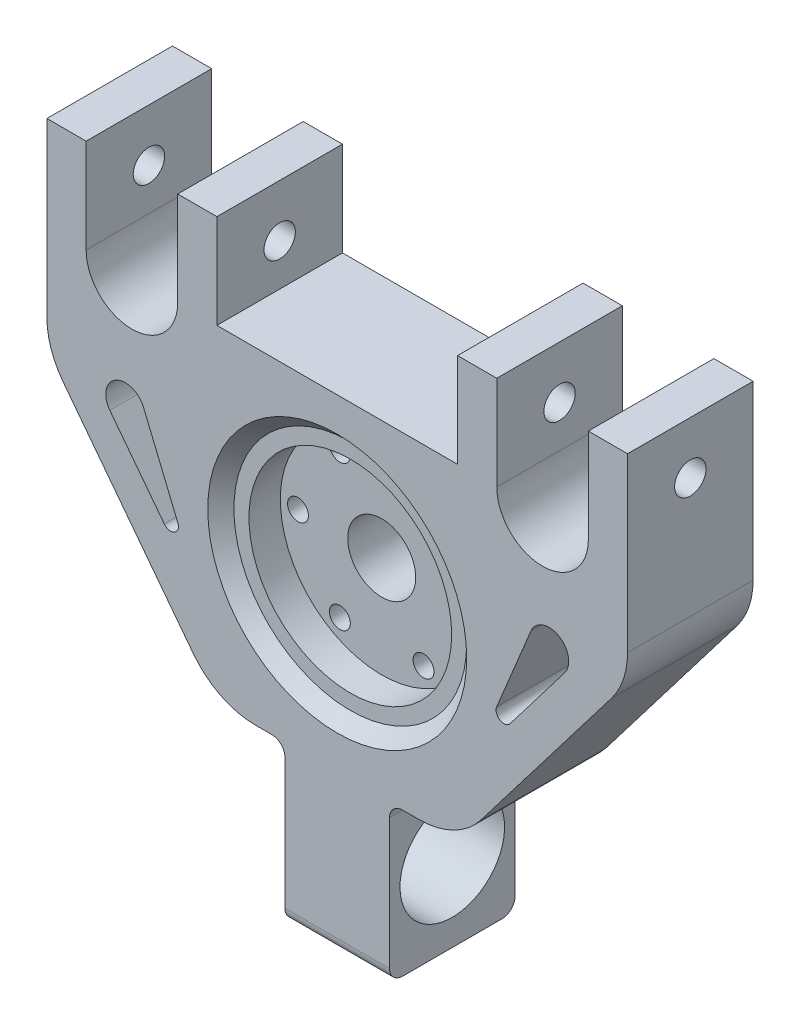
from build123d import *

# Parameters (mm, degrees)
DODANIE_WYCI_GNI_CIE1_DEPTH      = 13.5
DODANIE_WYCI_GNI_CIE1_DEPTH_BACK = 13.5
SZKIC1_W                         = 222
SZKIC1_H                         = 125
SZKIC1_R                         = 13
SZKIC1_R_2                       = 4
SZKIC4_W                         = 15
SZKIC4_H                         = 27
DODANIE_WYCI_GNI_CIE4_DEPTH      = 36
SZKIC13_R                        = 38.75
WYTNIJ_WYCI_GNI_CIE4_DEPTH       = 17
SZKIC15_R                        = 44.5
WYTNIJ_WYCI_GNI_CIE5_DEPTH       = 5
POCHYLENIE1_ANGLE                = 45
DODANIE_WYCI_GNI_CIE6_START      = 21
SZKIC16_R                        = 13
SZKIC16_R_2                      = 4
DODANIE_WYCI_GNI_CIE6_DEPTH      = 21
SZKIC5_R                         = 6
WYTNIJ_WYCI_GNI_CIE3_DEPTH       = 246.308988828
WYTNIJ_WYCI_GNI_CIE6_DEPTH       = 156.971952607
ZAOKR_GLENIE1_R                  = 30
ZAOKR_GLENIE2_R                  = 30
SZKIC19_W                        = 40
SZKIC19_H                        = 60
DODANIE_WYCI_GNI_CIE7_DEPTH      = 48
WYTNIJ_WYCI_GNI_CIE7_REACH       = 184.64
SZKIC23_R                        = 20
WYTNIJ_WYCI_GNI_CIE8_REACH       = 174.137
ZAOKR_GLENIE4_R                  = 5
ZAOKR_GLENIE5_R                  = 5
WYTNIJ_WYCI_GNI_CIE9_DEPTH       = 48


with BuildPart() as part:
    # Szkic1 → Dodanie-wyciągnięcie1 (new, two sides: drawn at the far end of the back side and taken through both)
    with BuildSketch(Plane.XY.offset(-DODANIE_WYCI_GNI_CIE1_DEPTH_BACK)):
        Rectangle(SZKIC1_W, SZKIC1_H)
        Circle(SZKIC1_R, mode=Mode.SUBTRACT)
        with Locations((-32, 0)):
            Circle(SZKIC1_R_2, mode=Mode.SUBTRACT)
        with Locations((-16, 27.712812921)):
            Circle(SZKIC1_R_2, mode=Mode.SUBTRACT)
        with Locations((16, 27.712812921)):
            Circle(SZKIC1_R_2, mode=Mode.SUBTRACT)
        with Locations((32, 0)):
            Circle(SZKIC1_R_2, mode=Mode.SUBTRACT)
        with Locations((16, -27.712812921)):
            Circle(SZKIC1_R_2, mode=Mode.SUBTRACT)
        with Locations((-16, -27.712812921)):
            Circle(SZKIC1_R_2, mode=Mode.SUBTRACT)
    extrude(amount=DODANIE_WYCI_GNI_CIE1_DEPTH + DODANIE_WYCI_GNI_CIE1_DEPTH_BACK)

    # Szkic4 → Dodanie-wyciągnięcie4 (add)
    with BuildSketch(Plane(origin=(0, 62.5, 0), x_dir=(1, 0, 0), z_dir=(0, 1, 0))):
        with Locations((-103.5, 0)):
            Rectangle(SZKIC4_W, SZKIC4_H)
        with Locations((-53.5, 0)):
            Rectangle(SZKIC4_W, SZKIC4_H)
        with Locations((53.5, 0)):
            Rectangle(SZKIC4_W, SZKIC4_H)
        with Locations((103.5, 0)):
            Rectangle(SZKIC4_W, SZKIC4_H)
    extrude(amount=DODANIE_WYCI_GNI_CIE4_DEPTH)

    # Szkic13 → Wytnij-wyciągnięcie4 (cut)
    with BuildSketch(Plane.XY.offset(13.5)):
        Circle(SZKIC13_R)
    extrude(amount=-WYTNIJ_WYCI_GNI_CIE4_DEPTH, mode=Mode.SUBTRACT)

    # Szkic15 → Wytnij-wyciągnięcie5 (cut)
    with BuildSketch(Plane.XY.offset(13.5)):
        Circle(SZKIC15_R)
    extrude(amount=-WYTNIJ_WYCI_GNI_CIE5_DEPTH, mode=Mode.SUBTRACT)

    # Pochylenie1
    pochylenie1_faces = [part.faces().sort_by_distance(p)[0] for p in [
        (-44.5, 0, 11),
    ]]
    draft(pochylenie1_faces, Plane.XY.offset(8.5), POCHYLENIE1_ANGLE)

    # Szkic16 → Dodanie-wyciągnięcie6 (add)
    with BuildSketch(Plane(origin=(0, 0, -13.5), x_dir=(-1, 0, 0), z_dir=(0, 0, -1)).offset(DODANIE_WYCI_GNI_CIE6_START)):
        Polygon((-111, 98.5), (-111, -62.5), (111, -62.5), (111, 98.5), (96, 98.5), (96, 62.5), (61, 62.5), (61, 98.5), (46, 98.5), (46, 62.5), (-46, 62.5), (-46, 98.5), (-61, 98.5), (-61, 62.5), (-96, 62.5), (-96, 98.5), align=None)
        with Locations(Location((0, 0, 0), (0, 0, 180))):
            Circle(SZKIC16_R, mode=Mode.SUBTRACT)
        with Locations(Location((32, 0, 0), (0, 0, 180))):
            Circle(SZKIC16_R_2, mode=Mode.SUBTRACT)
        with Locations(Location((16, 27.712812921, 0), (0, 0, 180))):
            Circle(SZKIC16_R_2, mode=Mode.SUBTRACT)
        with Locations(Location((-16, 27.712812921, 0), (0, 0, 180))):
            Circle(SZKIC16_R_2, mode=Mode.SUBTRACT)
        with Locations(Location((-32, 0, 0), (0, 0, 180))):
            Circle(SZKIC16_R_2, mode=Mode.SUBTRACT)
        with Locations(Location((-16, -27.712812921, 0), (0, 0, 180))):
            Circle(SZKIC16_R_2, mode=Mode.SUBTRACT)
        with Locations(Location((16, -27.712812921, 0), (0, 0, 180))):
            Circle(SZKIC16_R_2, mode=Mode.SUBTRACT)
    extrude(amount=-DODANIE_WYCI_GNI_CIE6_DEPTH)

    # Szkic5 → Wytnij-wyciągnięcie3 (cut, through all)
    with BuildSketch(Plane.ZY.offset(111)):
        with Locations((-10.5, 78.5)):
            Circle(SZKIC5_R)
    extrude(amount=-WYTNIJ_WYCI_GNI_CIE3_DEPTH, mode=Mode.SUBTRACT)

    # Szkic18 → Wytnij-wyciągnięcie6 (cut, through all)
    with BuildSketch(Plane(origin=(0, 0, -34.5), x_dir=(-1, 0, 0), z_dir=(0, 0, -1))):
        Polygon((111, 22.5), (46, -62.5), (111, -62.5), align=None)
        Polygon((-111, -62.5), (-46, -62.5), (-111, 22.5), align=None)
    extrude(amount=-WYTNIJ_WYCI_GNI_CIE6_DEPTH, mode=Mode.SUBTRACT)

    # Zaokrąglenie1
    zaokr_glenie1_edges = [part.edges().sort_by_distance(p)[0] for p in [
        (-111, 22.5, -10.5),
    ]]
    fillet(zaokr_glenie1_edges, radius=ZAOKR_GLENIE1_R)

    # Zaokrąglenie2
    zaokr_glenie2_edges = [part.edges().sort_by_distance(p)[0] for p in [
        (-46, -62.5, -10.5),
        (111, 22.5, -10.5),
        (46, -62.5, -10.5),
    ]]
    fillet(zaokr_glenie2_edges, radius=ZAOKR_GLENIE2_R)

    # Szkic19 → Dodanie-wyciągnięcie7 (add)
    with BuildSketch(Plane(origin=(0, 0, -34.5), x_dir=(-1, 0, 0), z_dir=(0, 0, -1))):
        with Locations((0, -92.5)):
            Rectangle(SZKIC19_W, SZKIC19_H)
    extrude(amount=-DODANIE_WYCI_GNI_CIE7_DEPTH)

    # Szkic23 → Wytnij-wyciągnięcie7 (cut, up to next)
    with BuildSketch(Plane(origin=(20, 0, 0), x_dir=(0, 0, -1), z_dir=(1, 0, 0)), mode=Mode.PRIVATE) as wytnij_wyci_gni_cie7_sk1:
        with Locations(Location((10.5, -92.5, 0), (0, 0, 90))):
            Circle(SZKIC23_R)
    wytnij_wyci_gni_cie7_tool1 = extrude(wytnij_wyci_gni_cie7_sk1.sketch, amount=-WYTNIJ_WYCI_GNI_CIE7_REACH, mode=Mode.PRIVATE) & part.part
    add(wytnij_wyci_gni_cie7_tool1.solids().sort_by_distance((20, -92.5, -10.5))[0], mode=Mode.SUBTRACT)

    # Szkic24 → Wytnij-wyciągnięcie8 (cut, up to next)
    with BuildSketch(Plane(origin=(0, 0, -34.5), x_dir=(-1, 0, 0), z_dir=(0, 0, -1)), mode=Mode.PRIVATE) as wytnij_wyci_gni_cie8_sk1:
        with BuildLine():
            Line((-96, 62.5), (-61, 62.5))
            ThreePointArc((-61, 62.5), (-78.5, 45), (-96, 62.5))
        make_face()
    wytnij_wyci_gni_cie8_tool1 = extrude(wytnij_wyci_gni_cie8_sk1.sketch, amount=-WYTNIJ_WYCI_GNI_CIE8_REACH, mode=Mode.PRIVATE) & part.part
    # Szkic24 → Wytnij-wyciągnięcie8 (cut, up to next)
    with BuildSketch(Plane(origin=(0, 0, -34.5), x_dir=(-1, 0, 0), z_dir=(0, 0, -1)), mode=Mode.PRIVATE) as wytnij_wyci_gni_cie8_sk2:
        with BuildLine():
            Line((61, 62.5), (96, 62.5))
            ThreePointArc((96, 62.5), (78.5, 45), (61, 62.5))
        make_face()
    wytnij_wyci_gni_cie8_tool2 = extrude(wytnij_wyci_gni_cie8_sk2.sketch, amount=-WYTNIJ_WYCI_GNI_CIE8_REACH, mode=Mode.PRIVATE) & part.part
    add(wytnij_wyci_gni_cie8_tool1.solids().sort_by_distance((78.5, 55.072769, -34.5))[0], mode=Mode.SUBTRACT)
    add(wytnij_wyci_gni_cie8_tool2.solids().sort_by_distance((-78.5, 55.072769, -34.5))[0], mode=Mode.SUBTRACT)

    # Zaokrąglenie4
    zaokr_glenie4_edges = [part.edges().sort_by_distance(p)[0] for p in [
        (20, -62.5, -10.5),
        (-20, -62.5, -10.5),
    ]]
    fillet(zaokr_glenie4_edges, radius=ZAOKR_GLENIE4_R)

    # Zaokrąglenie5
    zaokr_glenie5_edges = [part.edges().sort_by_distance(p)[0] for p in [
        (0, -122.5, -34.5),
        (0, -122.5, 13.5),
    ]]
    fillet(zaokr_glenie5_edges, radius=ZAOKR_GLENIE5_R)

    # Szkic25 → Wytnij-wyciągnięcie9 (cut)
    with BuildSketch(Plane.XY.offset(13.5)):
        with BuildLine():
            Line((-60.951491344, -10.353512592), (-74.069286372, 21.36621852))
            ThreePointArc((-74.069286372, 21.36621852), (-84.742802137, 24.999340902), (-86.957683747, 13.944124193))
            Line((-86.957683747, 13.944124193), (-66.106850294, -13.322350323))
            ThreePointArc((-66.106850294, -13.322350323), (-62.22665594, -14.099736361), (-60.951491344, -10.353512592))
        make_face()
        with BuildLine():
            Line((66.106850294, -13.322350323), (86.957683747, 13.944124193))
            ThreePointArc((86.957683747, 13.944124193), (84.742802137, 24.999340902), (74.069286372, 21.36621852))
            Line((74.069286372, 21.36621852), (60.951491344, -10.353512592))
            ThreePointArc((60.951491344, -10.353512592), (62.22665594, -14.099736361), (66.106850294, -13.322350323))
        make_face()
    extrude(amount=-WYTNIJ_WYCI_GNI_CIE9_DEPTH, mode=Mode.SUBTRACT)


solid = part.part
